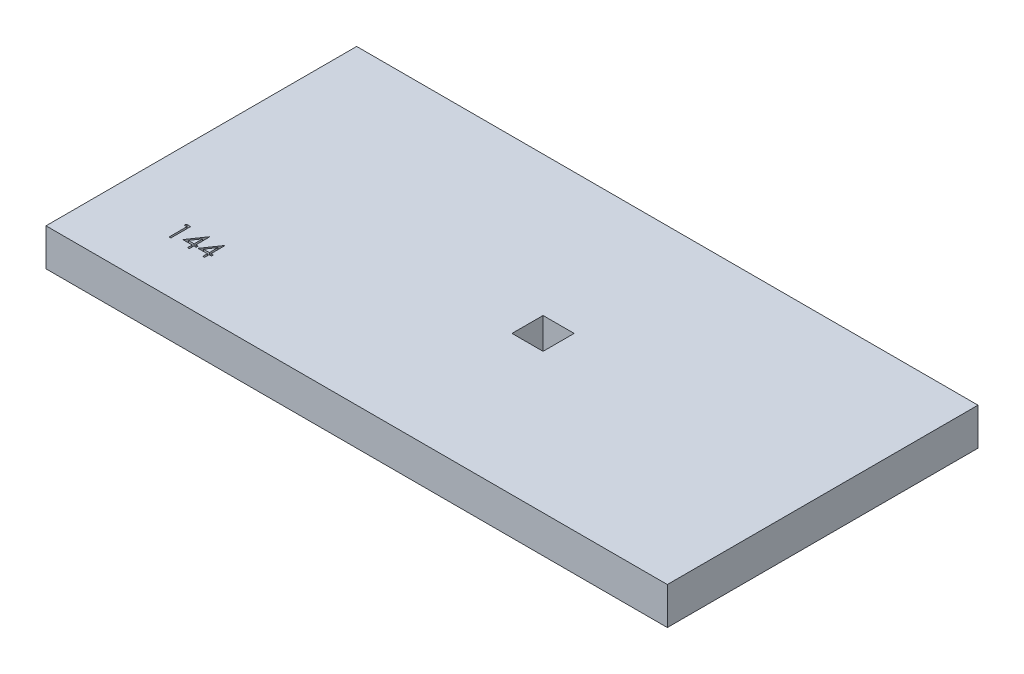
from build123d import *

# Parameters (mm, degrees)
SKETCH1_W           = 100
SKETCH1_H           = 50
BOSS_EXTRUDE1_DEPTH = 6
SKETCH2_W           = 5
SKETCH2_H           = 5
CUT_EXTRUDE1_DEPTH  = 6
CUT_EXTRUDE2_DEPTH  = 1


with BuildPart() as part:
    # Sketch1 → Boss-Extrude1 (new body)
    with BuildSketch(Plane(origin=(0, 0, 0), x_dir=(1, 0, 0), z_dir=(0, 1, 0))):
        Rectangle(SKETCH1_W, SKETCH1_H)
    extrude(amount=BOSS_EXTRUDE1_DEPTH)

    # Sketch2 → Cut-Extrude1 (cut)
    with BuildSketch(Plane(origin=(0, 6, 0), x_dir=(1, 0, 0), z_dir=(0, 1, 0))):
        with Locations((5, 0)):
            Rectangle(SKETCH2_W, SKETCH2_H)
    extrude(amount=-CUT_EXTRUDE1_DEPTH, mode=Mode.SUBTRACT)

    # Sketch3 → Cut-Extrude2 (cut)
    # profile 1 of 3: a face of its own
    with BuildSketch(Plane(origin=(0, 6, 0), x_dir=(1, 0, 0), z_dir=(0, 1, 0))):
        Polygon((-38.838837881, -13.469581545), (-38.25179361, -13.469581545), (-38.25179361, -16.644581545), (-38.536729508, -16.644581545), (-38.536729508, -13.795222571), (-39.025191046, -13.795222571), align=None)
    # profile 2 of 3: a face of its own
    with BuildSketch(Plane(origin=(0, 6, 0), x_dir=(1, 0, 0), z_dir=(0, 1, 0))):
        Polygon((-35.338196855, -13.388171289), (-35.280319251, -13.388171289), (-35.280319251, -15.586248212), (-34.913973097, -15.586248212), (-34.913973097, -15.911889237), (-35.280319251, -15.911889237), (-35.280319251, -16.644581545), (-35.565255149, -16.644581545), (-35.565255149, -15.911889237), (-37.071344892, -15.911889237), align=None)
        Polygon((-35.565255149, -15.586248212), (-35.565255149, -14.207361994), (-36.511649379, -15.586248212), align=None, mode=Mode.SUBTRACT)
    # profile 3 of 3: a face of its own
    with BuildSketch(Plane(origin=(0, 6, 0), x_dir=(1, 0, 0), z_dir=(0, 1, 0))):
        Polygon((-32.895889163, -13.388171289), (-32.838011559, -13.388171289), (-32.838011559, -15.586248212), (-32.471665405, -15.586248212), (-32.471665405, -15.911889237), (-32.838011559, -15.911889237), (-32.838011559, -16.644581545), (-33.122947456, -16.644581545), (-33.122947456, -15.911889237), (-34.6290372, -15.911889237), align=None)
        Polygon((-33.122947456, -15.586248212), (-33.122947456, -14.207361994), (-34.069341687, -15.586248212), align=None, mode=Mode.SUBTRACT)
    extrude(amount=-CUT_EXTRUDE2_DEPTH, mode=Mode.SUBTRACT)


solid = part.part
